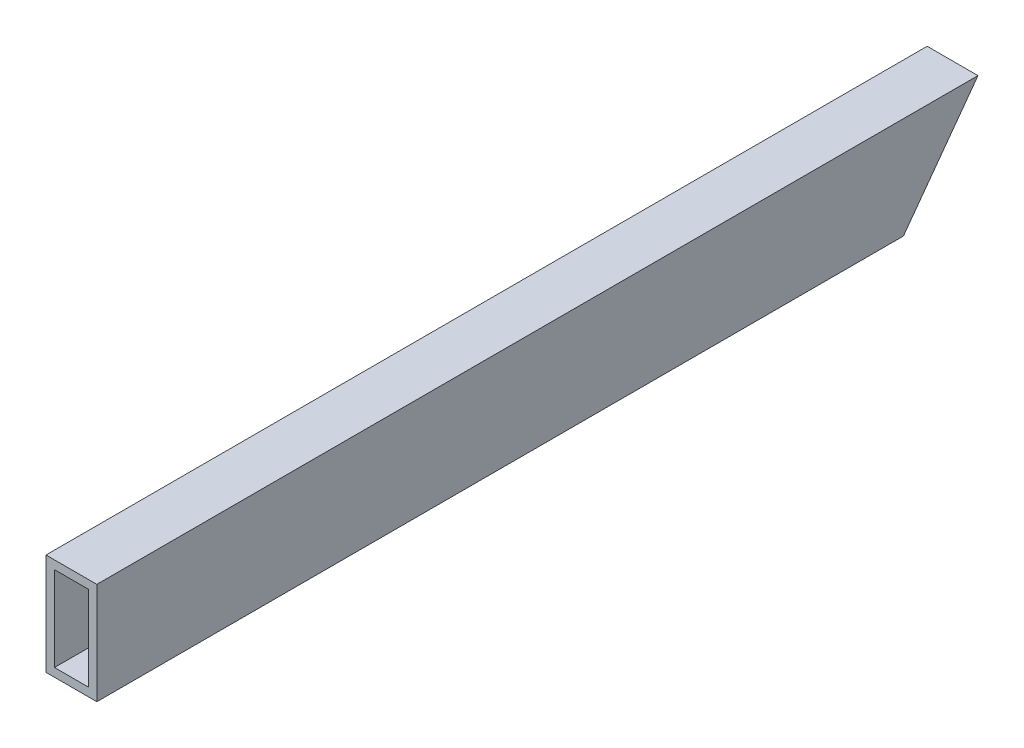
from build123d import *

# Parameters (mm, degrees)
SKETCH1_W           = 19.05
SKETCH1_H           = 38.1
SKETCH1_W_2         = 12.7
SKETCH1_H_2         = 31.75
BOSS_EXTRUDE1_DEPTH = 330.2
CUT_EXTRUDE1_DEPTH  = 332.297215503


with BuildPart() as part:
    # Sketch1 → Boss-Extrude1 (new body)
    with BuildSketch(Plane.XY):
        Rectangle(SKETCH1_W, SKETCH1_H)
        Rectangle(SKETCH1_W_2, SKETCH1_H_2, mode=Mode.SUBTRACT)
    extrude(amount=BOSS_EXTRUDE1_DEPTH)

    # Sketch2 → Cut-Extrude1 (cut, through all)
    with BuildSketch(Plane(origin=(9.525, 0, 0), x_dir=(0, 0, -1), z_dir=(1, 0, 0))):
        Polygon((0, 19.05), (-27.94, -19.05), (0, -19.05), align=None)
    extrude(amount=-CUT_EXTRUDE1_DEPTH, mode=Mode.SUBTRACT)


solid = part.part
